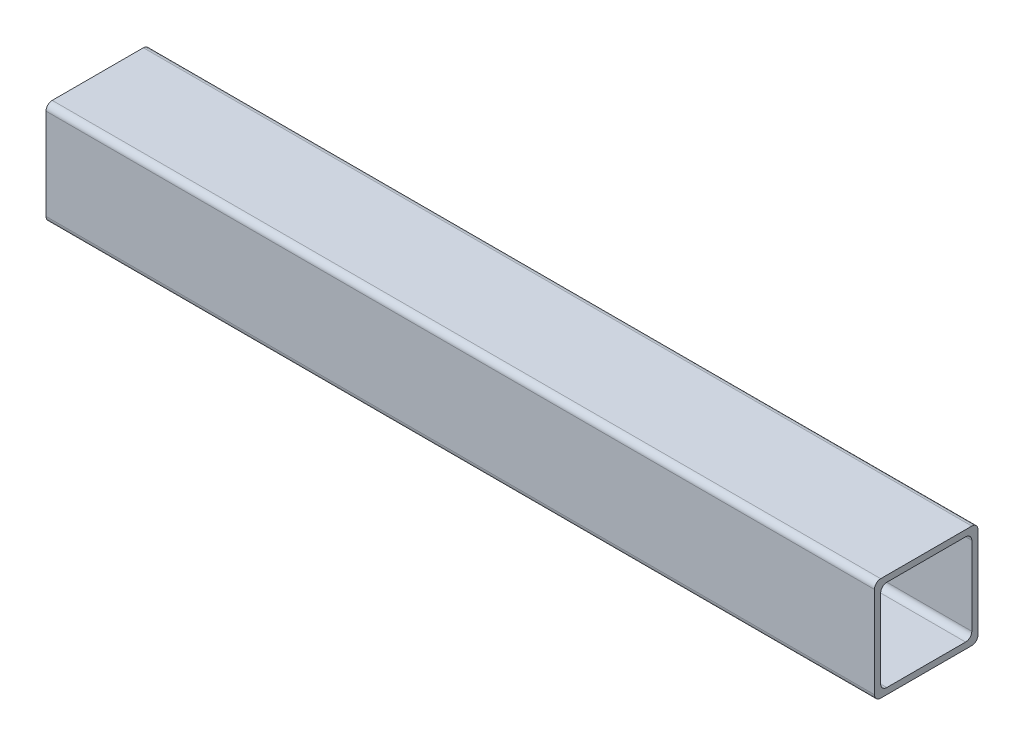
from build123d import *

# Parameters (mm, degrees)
BOSS_EXTRUDE1_DEPTH = 200


with BuildPart() as part:
    # Sketch1 → Boss-Extrude1 (new body)
    with BuildSketch(Plane(origin=(0, 0, 0), x_dir=(0, 0, -1), z_dir=(1, 0, 0))):
        with BuildLine():
            Line((1.5, 0), (23.5, 0))
            ThreePointArc((23.5, 0), (24.560660172, 0.439339828), (25, 1.5))
            Line((25, 1.5), (25, 23.5))
            ThreePointArc((25, 23.5), (24.560660172, 24.560660172), (23.5, 25))
            Line((23.5, 25), (1.5, 25))
            ThreePointArc((1.5, 25), (0.439339828, 24.560660172), (0, 23.5))
            Line((0, 23.5), (0, 1.5))
            ThreePointArc((0, 1.5), (0.439339828, 0.439339828), (1.5, 0))
        make_face()
        with BuildLine():
            Line((3, 23.5), (22, 23.5))
            ThreePointArc((22, 23.5), (23.060660172, 23.060660172), (23.5, 22))
            Line((23.5, 22), (23.5, 3))
            ThreePointArc((23.5, 3), (23.060660172, 1.939339828), (22, 1.5))
            Line((22, 1.5), (3, 1.5))
            ThreePointArc((3, 1.5), (1.939339828, 1.939339828), (1.5, 3))
            Line((1.5, 3), (1.5, 22))
            ThreePointArc((1.5, 22), (1.939339828, 23.060660172), (3, 23.5))
        make_face(mode=Mode.SUBTRACT)
    extrude(amount=BOSS_EXTRUDE1_DEPTH)


solid = part.part
